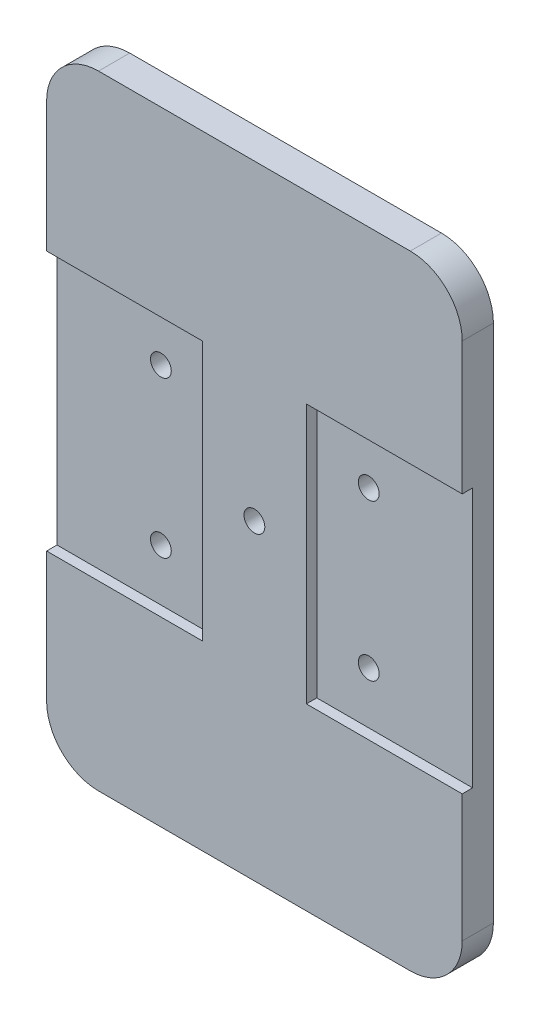
from build123d import *

# Parameters (mm, degrees)
SKETCH1_W           = 40
SKETCH1_H           = 60
BOSS_EXTRUDE4_DEPTH = 3
SKETCH5_W           = 15
SKETCH5_H           = 25
CUT_EXTRUDE2_DEPTH  = 1
SKETCH7_R           = 1
CUT_EXTRUDE3_DEPTH  = 2
SKETCH8_R           = 1
CUT_EXTRUDE4_DEPTH  = 2
FILLET1_R           = 5
SKETCH12_R          = 1
CUT_EXTRUDE6_DEPTH  = 12
SKETCH13_W          = 15
SKETCH13_H          = 25
CUT_EXTRUDE7_DEPTH  = 1
SKETCH14_R          = 1
CUT_EXTRUDE8_DEPTH  = 7


with BuildPart() as part:
    # Sketch1 → Boss-Extrude4 (new body)
    with BuildSketch(Plane.XY):
        with Locations((-45.9850693, -3.193565597)):
            Rectangle(SKETCH1_W, SKETCH1_H)
    extrude(amount=-BOSS_EXTRUDE4_DEPTH)

    # Sketch5 → Cut-Extrude2 (cut)
    with BuildSketch(Plane.XY):
        with Locations((-58.4850693, -3.193565597)):
            Rectangle(SKETCH5_W, SKETCH5_H)
    extrude(amount=-CUT_EXTRUDE2_DEPTH, mode=Mode.SUBTRACT)

    # Sketch7 → Cut-Extrude3 (cut)
    with BuildSketch(Plane.XY.offset(-1)):
        with Locations((-55.9850693, 4.306434403)):
            Circle(SKETCH7_R)
    extrude(amount=-CUT_EXTRUDE3_DEPTH, mode=Mode.SUBTRACT)

    # Sketch8 → Cut-Extrude4 (cut)
    with BuildSketch(Plane.XY.offset(-1)):
        with Locations((-55.9850693, -10.693565597)):
            Circle(SKETCH8_R)
    extrude(amount=-CUT_EXTRUDE4_DEPTH, mode=Mode.SUBTRACT)

    # Fillet1
    fillet1_edges = [part.edges().sort_by_distance(p)[0] for p in [
        (-65.9850693, 26.806434403, -1.5),
        (-65.9850693, -33.193565597, -1.5),
        (-25.9850693, -33.193565597, -1.5),
        (-25.9850693, 26.806434403, -1.5),
    ]]
    fillet(fillet1_edges, radius=FILLET1_R)

    # Sketch12 → Cut-Extrude6 (cut)
    with BuildSketch(Plane(origin=(0, 0, -3), x_dir=(-1, 0, 0), z_dir=(0, 0, -1))):
        with Locations((45.9850693, -3.193565597)):
            Circle(SKETCH12_R)
    extrude(amount=-CUT_EXTRUDE6_DEPTH, mode=Mode.SUBTRACT)

    # Sketch13 → Cut-Extrude7 (cut)
    with BuildSketch(Plane.XY):
        with Locations((-33.4850693, -3.4366123)):
            Rectangle(SKETCH13_W, SKETCH13_H)
    extrude(amount=-CUT_EXTRUDE7_DEPTH, mode=Mode.SUBTRACT)

    # Sketch14 → Cut-Extrude8 (cut)
    with BuildSketch(Plane.XY.offset(-1)):
        with Locations((-35.9850693, 4.0633877)):
            Circle(SKETCH14_R)
        with Locations((-35.9850693, -10.9366123)):
            Circle(SKETCH14_R)
    extrude(amount=-CUT_EXTRUDE8_DEPTH, mode=Mode.SUBTRACT)


solid = part.part
